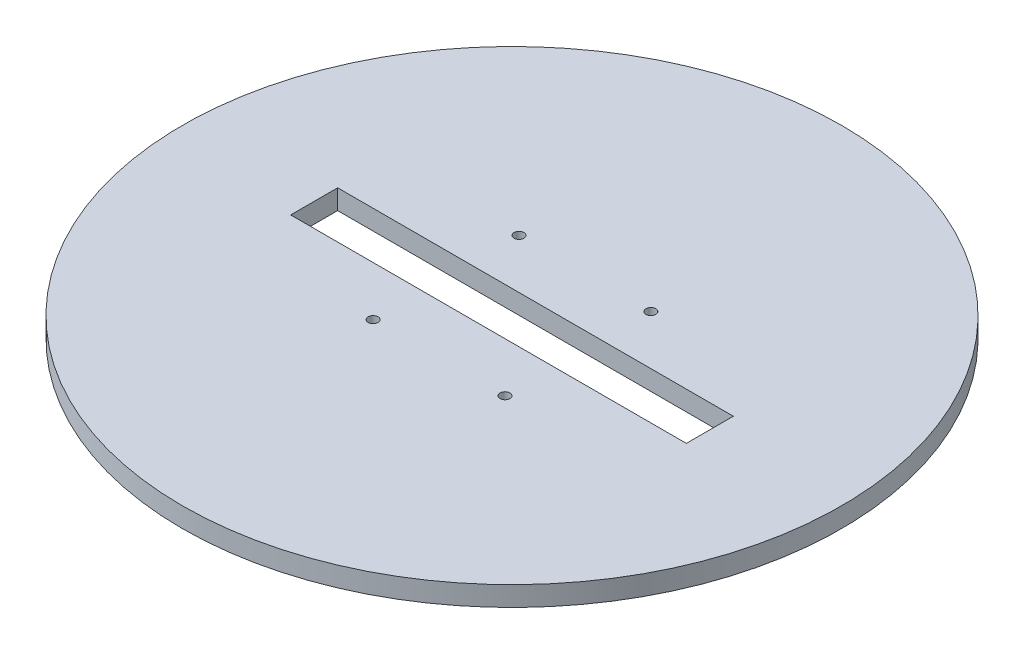
from build123d import *

# Parameters (mm, degrees)
SKETCH1_R           = 99.95
SKETCH1_W           = 120
SKETCH1_H           = 14.25
BOSS_EXTRUDE1_DEPTH = 6
SKETCH3_R           = 1.5
CUT_EXTRUDE1_DEPTH  = 142.477931141


with BuildPart() as part:
    # Sketch1 → Boss-Extrude1 (new body)
    with BuildSketch(Plane(origin=(0, 0, 0), x_dir=(1, 0, 0), z_dir=(0, 1, 0))):
        Circle(SKETCH1_R)
        Rectangle(SKETCH1_W, SKETCH1_H, mode=Mode.SUBTRACT)
    extrude(amount=BOSS_EXTRUDE1_DEPTH)

    # Sketch3 → Cut-Extrude1 (cut, through all)
    with BuildSketch(Plane(origin=(0, 6, 0), x_dir=(1, 0, 0), z_dir=(0, 1, 0))):
        with Locations((-20, -22.125)):
            Circle(SKETCH3_R)
        with Locations((20, -22.125)):
            Circle(SKETCH3_R)
        with Locations((20, 22.125)):
            Circle(SKETCH3_R)
        with Locations((-20, 22.125)):
            Circle(SKETCH3_R)
    extrude(amount=-CUT_EXTRUDE1_DEPTH, mode=Mode.SUBTRACT)


solid = part.part
